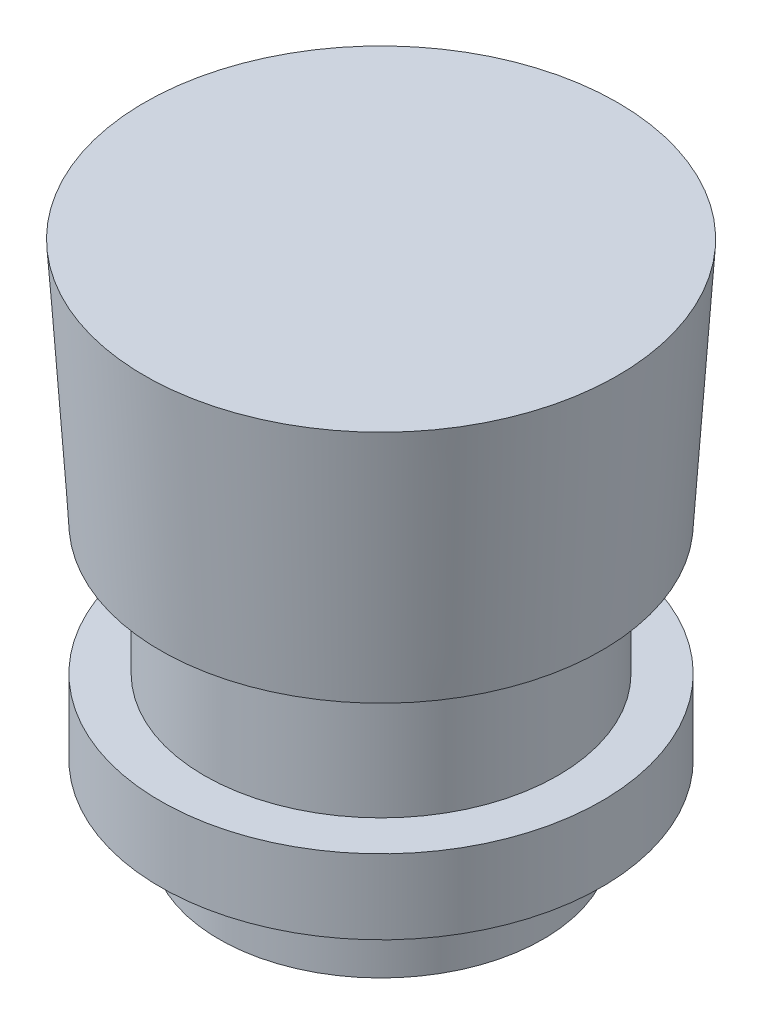
from build123d import *


with BuildPart() as part:
    # Sketch1 → Revolve1 (revolve)
    with BuildSketch(Plane.XY, mode=Mode.PRIVATE) as revolve1_sk:
        Polygon((0, 17.907), (-16.129, 17.907), (-15.049, 1.143), (-12.049, 1.143), (-12.049, -7.747), (-15.049, -7.747), (-15.049, -12.827), (-11.049, -12.827), (-11.049, -17.907), (0, -17.907), (0, 0), align=None)
    revolve(revolve1_sk.sketch.rotate(Axis((0, 0, 0), (0, 1, 0)), 270), axis=Axis((0, 0, 0), (0, 1, 0)))


solid = part.part
